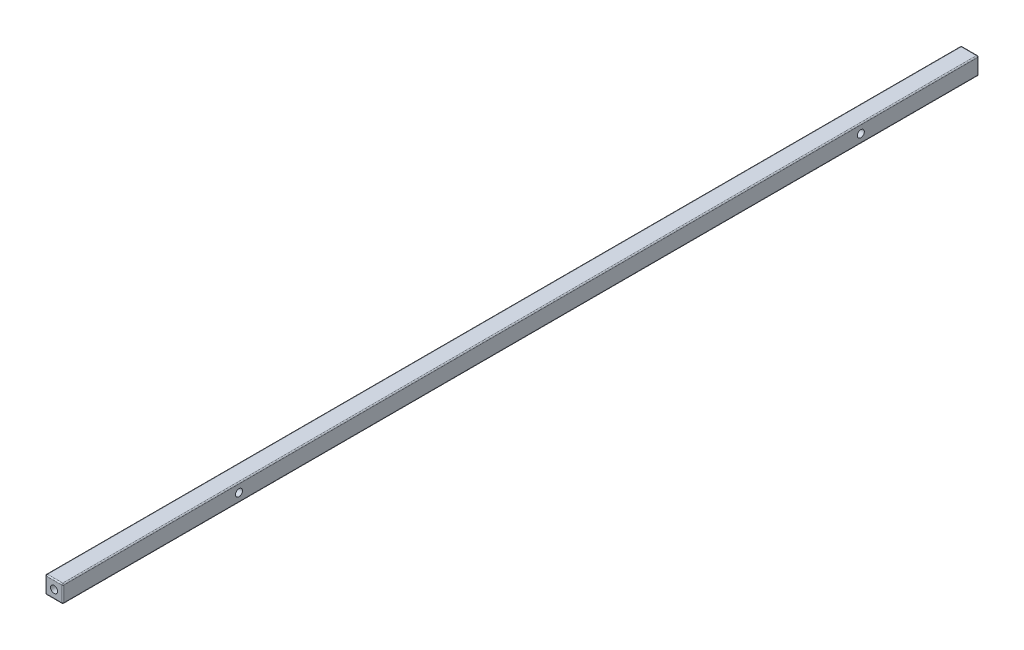
from build123d import *

# Parameters (mm, degrees)
SKETCH1_W           = 15
SKETCH1_H           = 15
BOSS_EXTRUDE1_DEPTH = 785
SKETCH2_R           = 3
CUT_EXTRUDE1_DEPTH  = 5
CUT_EXTRUDE2_START  = -5
SKETCH3_R           = 3
CUT_EXTRUDE2_DEPTH  = 5
FILLET1_R           = 1
SKETCH5_R           = 3
CUT_EXTRUDE4_DEPTH  = 786.286571896


with BuildPart() as part:
    # Sketch1 → Boss-Extrude1 (new body)
    with BuildSketch(Plane.XY):
        with Locations((7.5, 7.5)):
            Rectangle(SKETCH1_W, SKETCH1_H)
    extrude(amount=BOSS_EXTRUDE1_DEPTH)

    # Sketch2 → Cut-Extrude1 (cut)
    with BuildSketch(Plane(origin=(0, 0, 0), x_dir=(-1, 0, 0), z_dir=(0, 0, -1))):
        with Locations((-7.5, 7.5)):
            Circle(SKETCH2_R)
    extrude(amount=-CUT_EXTRUDE1_DEPTH, mode=Mode.SUBTRACT)

    # Sketch3 → Cut-Extrude2 (cut)
    with BuildSketch(Plane.XY.offset(785).offset(CUT_EXTRUDE2_START)):
        with Locations(Location((7.5, 7.5, 0), (0, 0, 180))):
            Circle(SKETCH3_R)
    extrude(amount=CUT_EXTRUDE2_DEPTH, mode=Mode.SUBTRACT)

    # Fillet1
    fillet1_edges = [part.edges().sort_by_distance(p)[0] for p in [
        (0, 7.5, 785),
        (7.5, 0, 785),
        (15, 7.5, 785),
        (7.5, 0, 0),
        (0, 7.5, 0),
        (7.5, 15, 0),
        (15, 7.5, 0),
        (15, 0, 392.5),
        (0, 0, 392.5),
        (0, 15, 392.5),
        (15, 15, 392.5),
        (7.5, 15, 785),
    ]]
    fillet(fillet1_edges, radius=FILLET1_R)

    # Sketch5 → Cut-Extrude4 (cut, through all)
    with BuildSketch(Plane(origin=(15, 0, 0), x_dir=(0, 0, -1), z_dir=(1, 0, 0))):
        with Locations((-101, 7.5)):
            Circle(SKETCH5_R)
        with Locations((-634, 7.5)):
            Circle(SKETCH5_R)
    extrude(amount=-CUT_EXTRUDE4_DEPTH, mode=Mode.SUBTRACT)


solid = part.part
